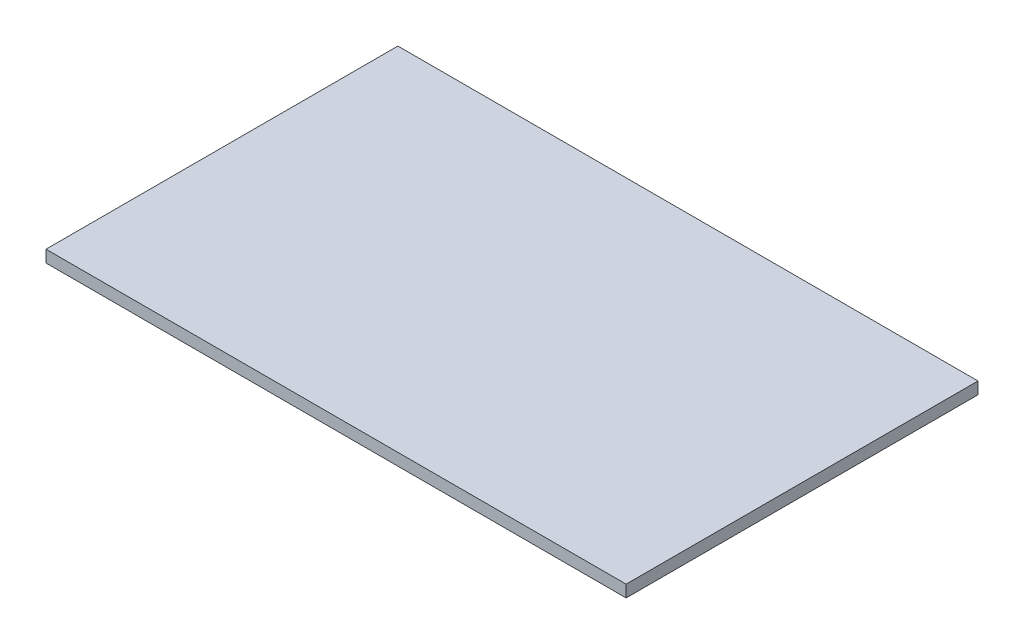
from build123d import *

# Parameters (mm, degrees)
ESBO_O1_W                = 61
ESBO_O1_H                = 37
RESSALTO_EXTRUS_O1_DEPTH = 1.26


with BuildPart() as part:
    # Esboço1 → Ressalto-extrusão1 (new body)
    with BuildSketch(Plane(origin=(0, 0, 0), x_dir=(1, 0, 0), z_dir=(0, 1, 0))):
        with Locations((30.5, 18.5)):
            Rectangle(ESBO_O1_W, ESBO_O1_H)
    extrude(amount=RESSALTO_EXTRUS_O1_DEPTH)


solid = part.part
